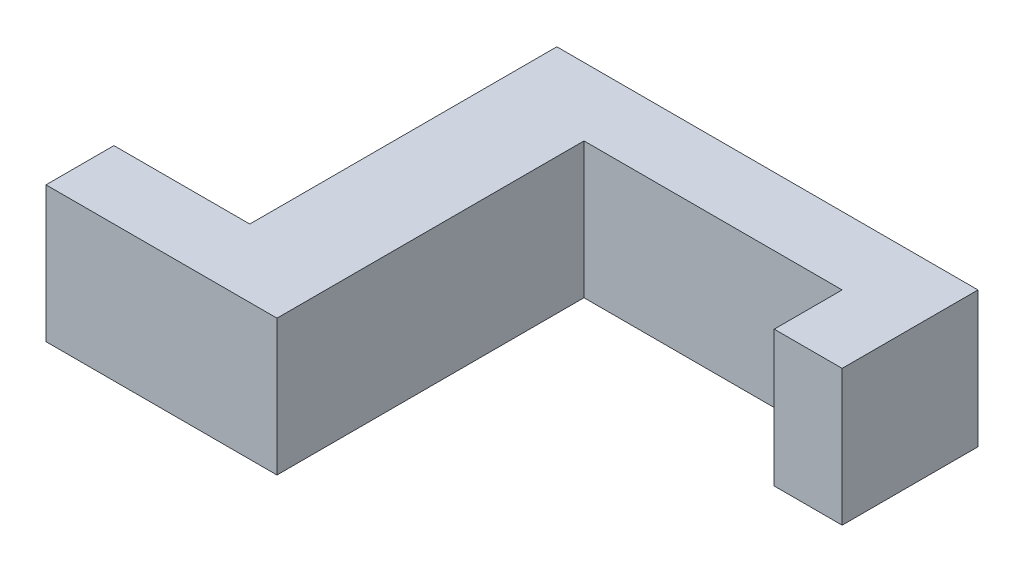
from build123d import *

# Parameters (mm, degrees)
BOSS_EXTRUDE1_DEPTH = 10


with BuildPart() as part:
    # Sketch1 → Boss-Extrude1 (new body)
    with BuildSketch(Plane(origin=(0, 0, 0), x_dir=(1, 0, 0), z_dir=(0, 1, 0))):
        Polygon((7, 17.6), (26, 17.6), (26, 12.6), (31, 12.6), (31, 22.6), (0, 22.6), (0, 0), (-10, 0), (-10, -5), (7, -5), align=None)
    extrude(amount=BOSS_EXTRUDE1_DEPTH)


solid = part.part
